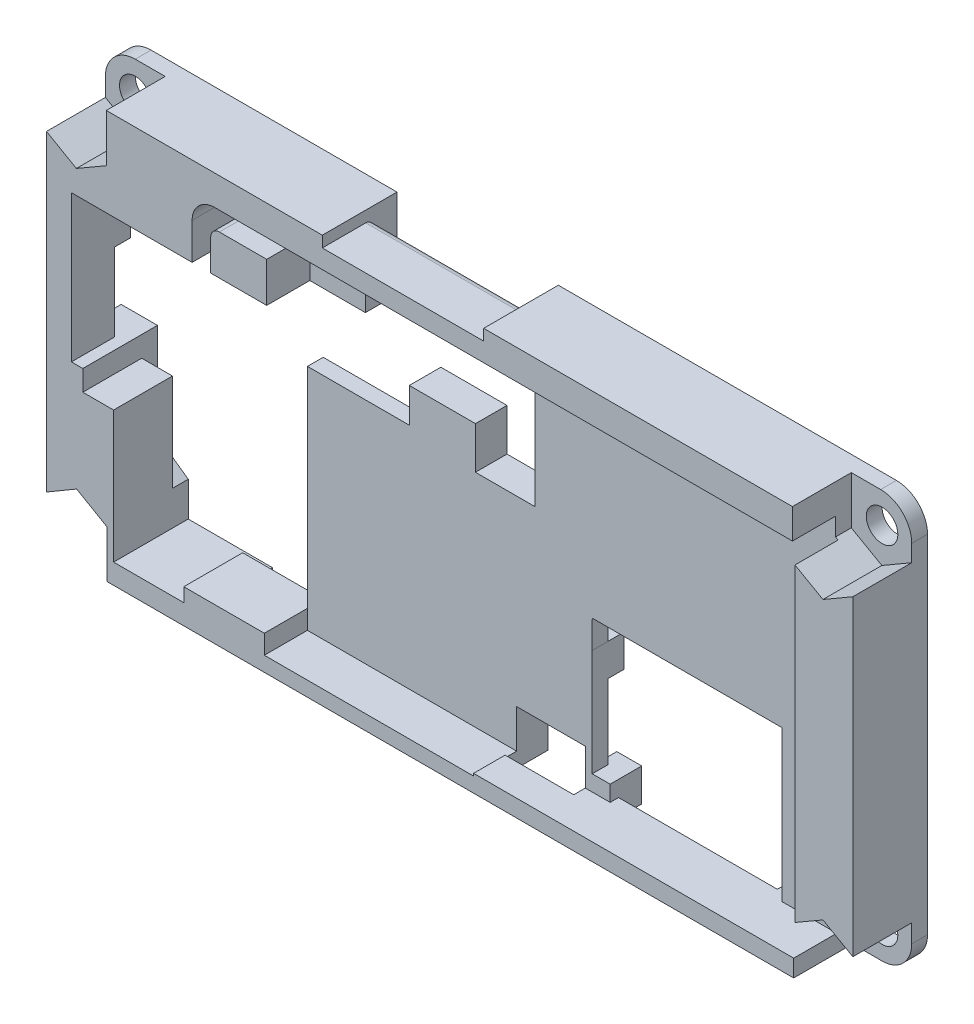
from build123d import *

# Parameters (mm, degrees)
SKETCH_1_R          = 1.5
EXTRUDE_1_DEPTH     = 1.5
EXTRUDE_1_2_DEPTH   = 1.5
EXTRUDE_1_3_DEPTH   = 1.5
SKETCH_1_W          = 5.434310226
SKETCH_1_H          = 3.069112814
EXTRUDE_1_4_DEPTH   = 1.5
SKETCH_1_W_2        = 2.364591514
SKETCH_1_H_2        = 3.137743857
EXTRUDE_1_5_DEPTH   = 1.5
EXTRUDE_2_DEPTH     = 1.5
SKETCH_5_W          = 28.57510237
SKETCH_5_H          = 2.837891342
SKETCH_5_W_2        = 23.917529704
SKETCH_5_H_2        = 1.634820582
EXTRUDE_3_DEPTH     = 4.1
SKETCH_6_W          = 0.787454543
SKETCH_6_H          = 7.1
EXTRUDE_4_DEPTH     = 2.837891342
EXTRUDE_5_DEPTH     = 15.344031237
CUT_EXTRUDE_1_DEPTH = 4.1
EXTRUDE_6_DEPTH     = 1.634820582
EXTRUDE_7_REACH     = 88.228
SKETCH_10_W         = 6.524128353
SKETCH_10_H         = 3


with BuildPart() as part:
    # 草图1 → 凸台-拉伸1 (new body)
    with BuildSketch(Plane.XY):
        with BuildLine():
            Line((42.374172917, 38.777020574), (73.737536195, 38.777020574))
            ThreePointArc((73.737536195, 38.777020574), (75.829099502, 37.910666686), (76.695453391, 35.819103378))
            Line((76.695453391, 35.819103378), (76.695453391, 2.836372873))
            ThreePointArc((76.695453391, 2.836372873), (75.868418762, 0.839734655), (73.871780544, 0.012700025))
            Line((73.871780544, 0.012700025), (65.856491688, 0.012700025))
            Line((65.856491688, 0.012700025), (65.856491688, 13.044712807))
            Line((65.856491688, 13.044712807), (70.100741351, 13.044712807))
            Line((70.100741351, 13.044712807), (70.100741351, 20.05420005))
            Line((70.100741351, 20.05420005), (44.751683648, 20.05420005))
            Line((44.751683648, 20.05420005), (44.751683648, 16.790663202))
            Line((44.751683648, 16.790663202), (30.415811039, 16.790663202))
            Line((30.415811039, 16.790663202), (30.415811039, 26.437124649))
            Line((30.415811039, 26.437124649), (36.705891976, 26.437124649))
            Line((36.705891976, 26.437124649), (36.705891976, 22.429523721))
            Line((36.705891976, 22.429523721), (44.751683648, 22.429523721))
            Line((44.751683648, 22.429523721), (44.751683648, 32.470424916))
            Line((44.751683648, 32.470424916), (42.374172917, 32.470424916))
            Line((42.374172917, 32.470424916), (42.374172917, 38.777020574))
        make_face()
        with Locations((73.871780544, 2.882016764)):
            Circle(SKETCH_1_R, mode=Mode.SUBTRACT)
        with Locations((73.871780544, 35.894081788)):
            Circle(SKETCH_1_R, mode=Mode.SUBTRACT)
    extrude(amount=EXTRUDE_1_DEPTH)



with BuildPart() as body_2:
    # 草图1 → Extrude 1 2 (new body)
    with BuildSketch(Plane.XY):
        with BuildLine():
            Line((20.832405991, 0.012700025), (2.882016764, 0.012700025))
            ThreePointArc((2.882016764, 0.012700025), (0.853103441, 0.853103441), (0.012700025, 2.882016764))
            Line((0.012700025, 2.882016764), (0.012700025, 16.410813367))
            Line((0.012700025, 16.410813367), (3.46840969, 16.410813367))
            Line((3.46840969, 16.410813367), (3.46840969, 7.290825892))
            Line((3.46840969, 7.290825892), (6.394972835, 5.203664579))
            Line((6.394972835, 5.203664579), (6.394972835, 1.925003773))
            Line((6.394972835, 1.925003773), (14.41516881, 1.925003773))
            Line((14.41516881, 1.925003773), (14.41516881, 1.467481791))
            Line((14.41516881, 1.467481791), (20.832405991, 1.467481791))
            Line((20.832405991, 1.467481791), (33.595883095, 1.467481791))
            Line((33.595883095, 1.467481791), (33.595883095, 4.637617134))
            Line((33.595883095, 4.637617134), (40.626678312, 4.637617134))
            Line((40.626678312, 4.637617134), (40.626678312, 0.012700025))
            Line((40.626678312, 0.012700025), (33.595883095, 0.012700025))
            Line((33.595883095, 0.012700025), (20.832405991, 0.012700025))
        make_face()
        with Locations((2.902413005, 2.882016764)):
            Circle(SKETCH_1_R, mode=Mode.SUBTRACT)
    extrude(amount=EXTRUDE_1_2_DEPTH)


with BuildPart() as body_3:
    # 草图1 → Extrude 1 3 (new body)
    with BuildSketch(Plane.XY):
        with BuildLine():
            Line((2.857505715, 38.777020574), (26.242687137, 38.777020574))
            Line((26.242687137, 38.777020574), (26.242687137, 30.345137506))
            Line((26.242687137, 30.345137506), (2.385627897, 30.345137506))
            Line((2.385627897, 30.345137506), (2.385627897, 30.834185958))
            Line((2.385627897, 30.834185958), (0.012700025, 30.834185958))
            Line((0.012700025, 30.834185958), (0.012700025, 35.932214884))
            ThreePointArc((0.012700025, 35.932214884), (0.845924321, 37.943796279), (2.857505715, 38.777020574))
        make_face()
        with Locations((2.857505715, 35.877571755)):
            Circle(SKETCH_1_R, mode=Mode.SUBTRACT)
    extrude(amount=EXTRUDE_1_3_DEPTH)


with BuildPart() as body_4:
    # 草图1 → Extrude 1 4 (new body)
    with BuildSketch(Plane.XY):
        with Locations((45.09132803, 11.774429054)):
            Rectangle(SKETCH_1_W, SKETCH_1_H)
    extrude(amount=EXTRUDE_1_4_DEPTH)


with BuildPart() as body_5:
    # 草图1 → Extrude 1 5 (new body)
    with BuildSketch(Plane.XY):
        with Locations((48.333102422, 1.581571954)):
            Rectangle(SKETCH_1_W_2, SKETCH_1_H_2)
    extrude(amount=EXTRUDE_1_5_DEPTH)


with BuildPart() as part_1:
    add(part.part)

    add(body_2.part)  # 凸台-拉伸2 merges body 2

    add(body_3.part)  # 凸台-拉伸2 merges body 3

    add(body_4.part)  # 凸台-拉伸2 merges body 4

    add(body_5.part)  # 凸台-拉伸2 merges body 5
    # 草图3 → 凸台-拉伸2 (add)
    with BuildSketch(Plane.XY.offset(1.5)):
        Polygon((0.012700025, 34.205237949), (0.012700025, 30.834185958), (0.012700025, 23.817436756), (2.385627897, 23.817436756), (2.385627897, 30.345137506), (26.242687137, 30.345137506), (26.242687137, 38.777020574), (5.701940925, 38.777020574), (5.701940925, 34.225848847), (2.857505715, 32.577891407), align=None)
        Polygon((42.374172917, 38.777020574), (70.949275287, 38.777020574), (70.949275287, 34.225848847), (73.852441207, 32.577891407), (76.695453391, 34.225848847), (76.695453391, 4.574174261), (73.852441207, 6.187985945), (71.068336369, 4.574174261), (71.068336369, 0.012700025), (65.856491688, 0.012700025), (65.856491688, 13.044712807), (65.856491688, 15.972548736), (47.813055626, 15.972548736), (47.808483143, 13.308985461), (47.808483143, 3.150443882), (49.515398179, 3.150443882), (49.515398179, 0.012700025), (47.150806665, 0.012700025), (47.150806665, 5.096192633), (42.374172917, 5.096192633), (40.626678312, 5.096192633), (40.626678312, 4.637617134), (40.626678312, 0.012700025), (40.056713733, 0.012700025), (5.783059857, 0.012700025), (5.783059857, 4.506035797), (2.882016764, 6.187985945), (0.012700025, 4.506035797), (0.012700025, 16.410813367), (3.46840969, 16.410813367), (3.46840969, 14.453016608), (6.394972835, 14.453016608), (6.394972835, 10.104845947), (6.394972835, 5.203664579), (6.394972835, 1.925003773), (13.068362142, 1.925003773), (13.068362142, 3.23686167), (20.727981914, 3.23686167), (20.727981914, 23.163322327), (30.415811039, 23.163322327), (30.415811039, 26.437124649), (36.705891976, 26.437124649), (36.705891976, 22.429523721), (42.374172917, 22.429523721), align=None)
    extrude(amount=EXTRUDE_2_DEPTH)

    # 草图5 → 凸台-拉伸3 (add)
    with BuildSketch(Plane.XY.offset(3)):
        with Locations((56.661724102, 37.358074903)):
            Rectangle(SKETCH_5_W, SKETCH_5_H)
        Polygon((76.695453391, 34.225848847), (73.852441207, 32.577891407), (71.189142318, 34.089690367), (71.189142318, 4.64419966), (73.852441207, 6.187985945), (76.695453391, 4.574174261), align=None)
        with Locations((59.109571517, 0.830110316)):
            Rectangle(SKETCH_5_W_2, SKETCH_5_H_2)
        Polygon((40.626678312, 0.012700025), (6.394972835, 0.012700025), (5.783059857, 0.012700025), (5.783059857, 4.506035797), (2.882016764, 6.187985945), (0.012700025, 4.506035797), (0.012700025, 16.410813367), (0.012700025, 23.817436756), (0.012700025, 34.205237949), (2.857505715, 32.577891407), (5.701940925, 34.225848847), (5.701940925, 38.777020574), (26.242687137, 38.777020574), (26.242687137, 35.939129232), (20.953318595, 35.939129232), (20.953318595, 30.345137506), (2.385627897, 30.345137506), (2.385627897, 23.817436756), (2.385627897, 16.410813367), (3.46840969, 16.410813367), (3.46840969, 14.453016608), (6.394972835, 14.453016608), (6.394972835, 1.925003773), (13.068362142, 1.925003773), (13.068362142, 3.23686167), (20.727981914, 3.23686167), (20.727981914, 1.423006096), (40.626678312, 1.423006096), align=None)
    extrude(amount=EXTRUDE_3_DEPTH)

    # 草图6 → 凸台-拉伸4 (add)
    with BuildSketch(Plane(origin=(0, 38.777020574, 0), x_dir=(1, 0, 0), z_dir=(0, 1, 0))):
        with Locations((41.980445645, -3.55)):
            Rectangle(SKETCH_6_W, SKETCH_6_H)
    extrude(amount=-EXTRUDE_4_DEPTH)

    # 草图7 → 凸台-拉伸5 (add)
    with BuildSketch(Plane.ZY.offset(-41.586718374)):
        with BuildLine():
            Line((7.1, 35.939129232), (2.269100337, 35.939129232))
            Line((2.269100337, 35.939129232), (2.269100337, 37.022377445))
            ThreePointArc((2.269100337, 37.022377445), (2.47412559, 37.517352192), (2.969100337, 37.722377445))
            Line((2.969100337, 37.722377445), (7.1, 37.722377445))
            Line((7.1, 37.722377445), (7.1, 35.939129232))
        make_face()
    extrude(amount=EXTRUDE_5_DEPTH)

    # 草图8 → 切除-拉伸1 (cut)
    with BuildSketch(Plane.XY.offset(7.1)):
        with BuildLine():
            Line((20.953318595, 35.939129232), (15.992068639, 35.939129232))
            ThreePointArc((15.992068639, 35.939129232), (14.486042091, 35.31531261), (13.862225469, 33.809286062))
            Line((13.862225469, 33.809286062), (13.862225469, 30.345137506))
            Line((13.862225469, 30.345137506), (15.632095679, 30.345137506))
            Line((15.632095679, 30.345137506), (15.632095679, 33.321819521))
            ThreePointArc((15.632095679, 33.321819521), (15.872616168, 33.902487347), (16.453283994, 34.143007835))
            Line((16.453283994, 34.143007835), (20.953318595, 34.143007835))
            Line((20.953318595, 34.143007835), (20.953318595, 35.939129232))
        make_face()
    extrude(amount=-CUT_EXTRUDE_1_DEPTH, mode=Mode.SUBTRACT)

    # 草图9 → 凸台-拉伸6 (add)
    with BuildSketch(Plane.XZ.offset(-0.012700025)):
        Polygon((49.515398179, 2.203775642), (64.615113945, 2.203775642), (64.615113945, 0), (65.856491688, 0), (65.856491688, 3), (49.515398179, 3), align=None)
    extrude(amount=-EXTRUDE_6_DEPTH)

    # 凸台-拉伸7: up to this face of the body (flat: up to its plane)
    extrude_7_end = Plane(part_1.part.faces().sort_by_distance((59.094076967, 1.647520607, 4.675215674))[0])
    # 草图10 → 凸台-拉伸7 (add, up to the picked face)
    with BuildSketch(Plane.XZ.offset(-0.012700025), mode=Mode.PRIVATE) as extrude_7_sk1:
        with Locations((43.888742489, 5.6)):
            Rectangle(SKETCH_10_W, SKETCH_10_H)
    extrude_7_tool1 = split(extrude(extrude_7_sk1.sketch, amount=-EXTRUDE_7_REACH, mode=Mode.PRIVATE), bisect_by=extrude_7_end, keep=Keep.BOTH, mode=Mode.PRIVATE)
    add(extrude_7_tool1.solids().sort_by(Axis((43.888742, 0.0127, 5.6), (0, 1, 0)))[0])


solid = part_1.part
